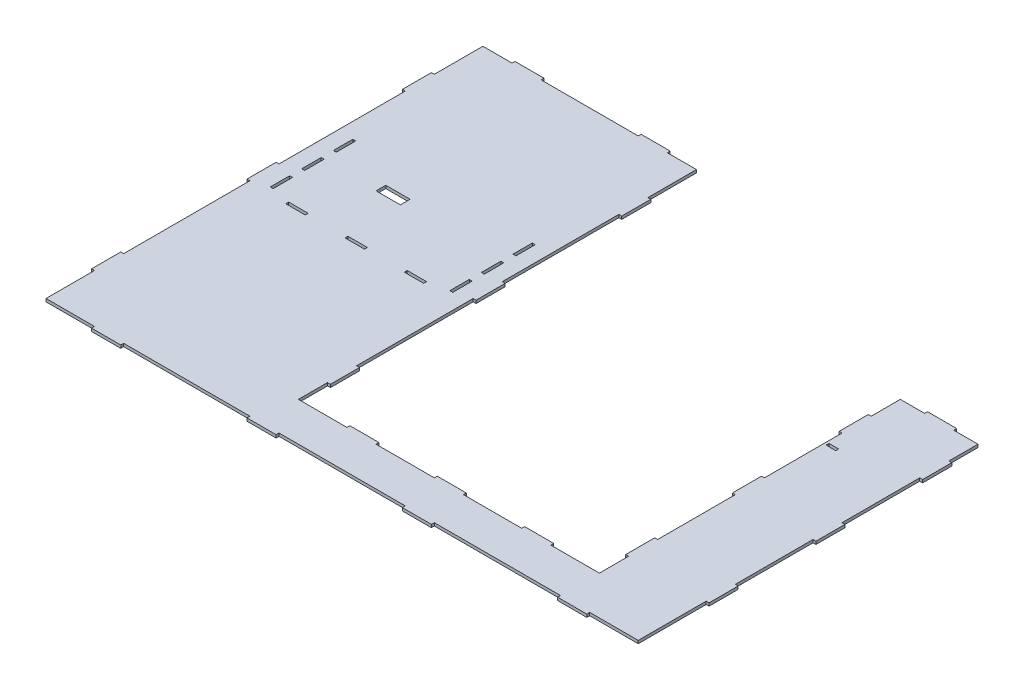
from build123d import *

# Parameters (mm, degrees)
SKETCH1_W           = 20
SKETCH1_H           = 3
SKETCH1_W_2         = 3
SKETCH1_H_2         = 20
BOSS_EXTRUDE1_DEPTH = 3
SKETCH2_W           = 10
SKETCH2_H           = 3
SKETCH2_W_2         = 25
SKETCH2_H_2         = 10
CUT_EXTRUDE1_DEPTH  = 10


with BuildPart() as part:
    # Sketch1 → Boss-Extrude1 (new body)
    with BuildSketch(Plane(origin=(0, 0, 0), x_dir=(1, 0, 0), z_dir=(0, 1, 0))):
        Polygon((0, 50), (0, 0), (50, 0), (50, -3), (80, -3), (80, 0), (210, 0), (210, -3), (240, -3), (240, 0), (370, 0), (370, -3), (400, -3), (400, 0), (530, 0), (530, -3), (560, -3), (560, 0), (610, 0), (610, 70), (613, 70), (613, 100), (610, 100), (610, 180), (613, 180), (613, 210), (610, 210), (610, 290), (613, 290), (613, 320), (610, 320), (610, 350), (585, 350), (585, 353), (555, 353), (555, 350), (530, 350), (530, 320), (527, 320), (527, 290), (530, 290), (530, 210), (527, 210), (527, 180), (530, 180), (530, 100), (527, 100), (527, 70), (530, 70), (530, 40), (480, 40), (480, 43), (450, 43), (450, 40), (390, 40), (390, 43), (360, 43), (360, 40), (300, 40), (300, 43), (270, 43), (270, 40), (220, 40), (220, 70), (223, 70), (223, 100), (220, 100), (220, 220), (223, 220), (223, 250), (220, 250), (220, 370), (223, 370), (223, 400), (220, 400), (220, 450), (190, 450), (190, 453), (160, 453), (160, 450), (60, 450), (60, 453), (30, 453), (30, 450), (0, 450), (0, 400), (-3, 400), (-3, 370), (0, 370), (0, 240), (-3, 240), (-3, 210), (0, 210), (0, 80), (-3, 80), (-3, 50), align=None)
        with Locations((49, 209.5)):
            Rectangle(SKETCH1_W, SKETCH1_H, mode=Mode.SUBTRACT)
        with Locations((110, 209.5)):
            Rectangle(SKETCH1_W, SKETCH1_H, mode=Mode.SUBTRACT)
        with Locations((171, 209.5)):
            Rectangle(SKETCH1_W, SKETCH1_H, mode=Mode.SUBTRACT)
        with Locations((17.5, 225)):
            Rectangle(SKETCH1_W_2, SKETCH1_H_2, mode=Mode.SUBTRACT)
        with Locations((17.5, 257.5)):
            Rectangle(SKETCH1_W_2, SKETCH1_H_2, mode=Mode.SUBTRACT)
        with Locations((17.5, 290)):
            Rectangle(SKETCH1_W_2, SKETCH1_H_2, mode=Mode.SUBTRACT)
        with Locations((202.5, 225)):
            Rectangle(SKETCH1_W_2, SKETCH1_H_2, mode=Mode.SUBTRACT)
        with Locations((202.5, 257.5)):
            Rectangle(SKETCH1_W_2, SKETCH1_H_2, mode=Mode.SUBTRACT)
        with Locations((202.5, 290)):
            Rectangle(SKETCH1_W_2, SKETCH1_H_2, mode=Mode.SUBTRACT)
    extrude(amount=BOSS_EXTRUDE1_DEPTH)

    # Sketch2 → Cut-Extrude1 (cut)
    with BuildSketch(Plane(origin=(0, 3, 0), x_dir=(1, 0, 0), z_dir=(0, 1, 0))):
        with Locations((537.5, 272.5)):
            Rectangle(SKETCH2_W, SKETCH2_H)
        with Locations((86.5, 271)):
            Rectangle(SKETCH2_W_2, SKETCH2_H_2)
    extrude(amount=-CUT_EXTRUDE1_DEPTH, mode=Mode.SUBTRACT)


solid = part.part
